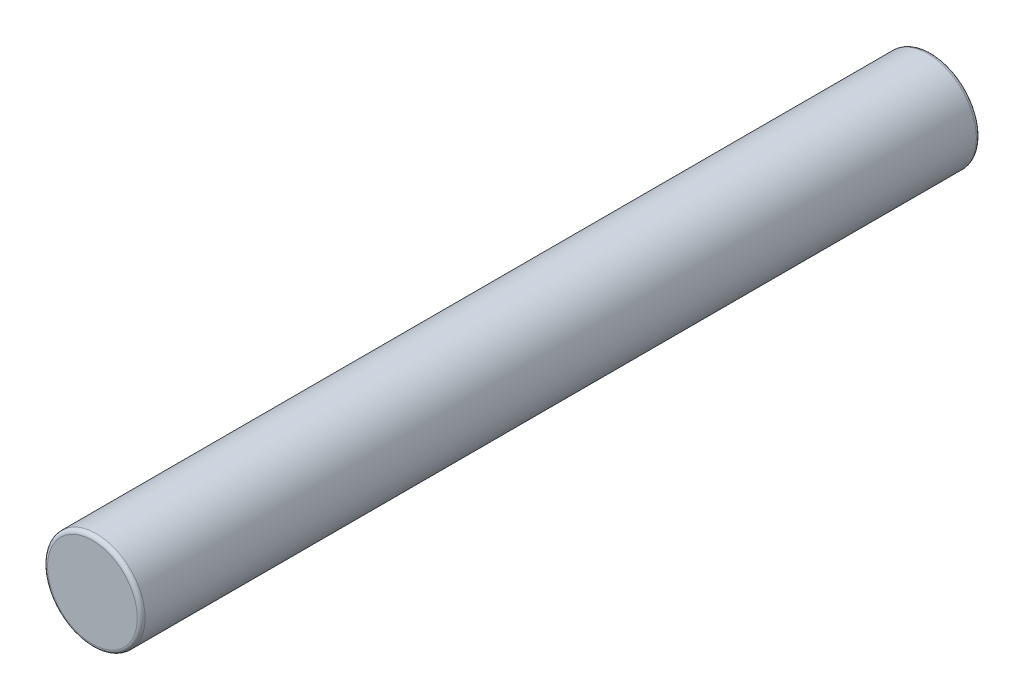
from build123d import *

# Parameters (mm, degrees)
ESQUISSE1_R      = 2.5
EXTRUSION1_DEPTH = 21.5
CONG_1_R         = 0.2


with BuildPart() as part:
    # Esquisse1 → Extrusion1 (new, symmetric)
    with BuildSketch(Plane.XY):
        Circle(ESQUISSE1_R)
    extrude(amount=EXTRUSION1_DEPTH, both=True)

    # Congé1
    cong_1_edges = [part.edges().sort_by_distance(p)[0] for p in [
        (-2.5, 0, -21.5),
        (-2.5, 0, 21.5),
    ]]
    fillet(cong_1_edges, radius=CONG_1_R)


solid = part.part
